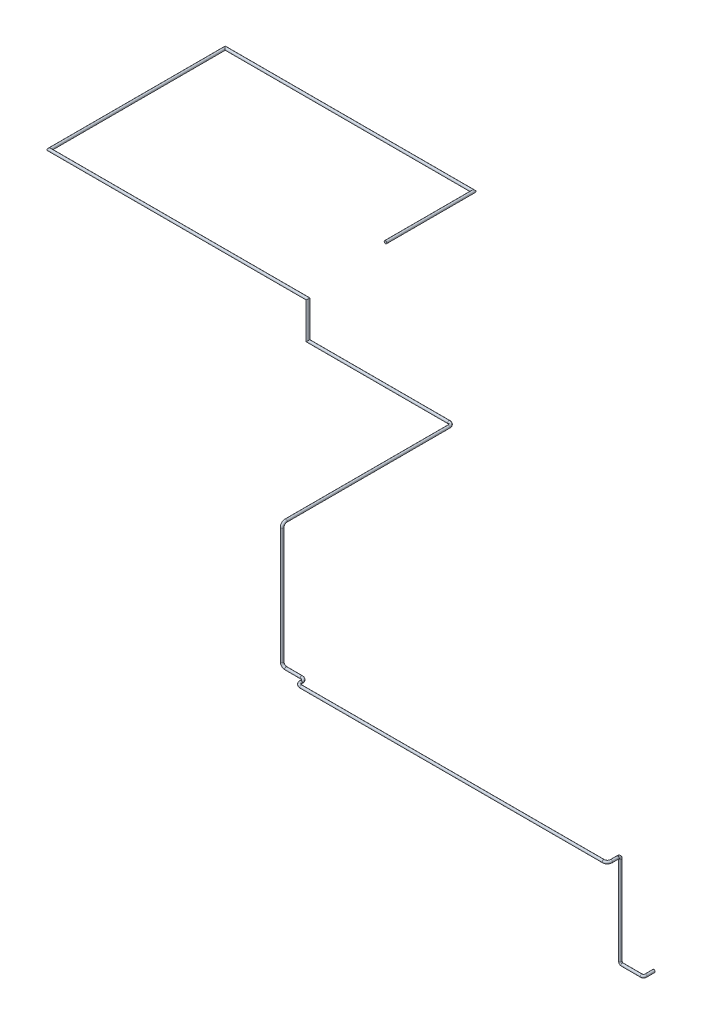
from build123d import *

# Parameters (mm, degrees)
CROQUIS1_R              = 25.4
SALIENTE_EXTRUIR1_DEPTH = 100
CROQUIS6_R              = 25.4
CROQUIS7_R              = 25


with BuildPart() as part:
    # Croquis1 → Saliente-Extruir1 (new body)
    with BuildSketch(Plane.XY):
        Circle(CROQUIS1_R)
    extrude(amount=SALIENTE_EXTRUIR1_DEPTH)

    # Barrer2: sweep along a curve in space
    with BuildLine() as barrer2_path:
        Line((0, 0, 100), (0, 0, 125))
        ThreePointArc((0, 0, 125), (-21.966991411, 0, 178.033008589), (-75, 0, 200))
        Line((-75, 0, 200), (-5925, 0, 200))
        ThreePointArc((-5925, 0, 200), (-5978.033008589, 0, 178.033008589), (-6000, 0, 125))
        Line((-6000, 0, 125), (-6000, 0, 115))
        ThreePointArc((-6000, 0, 115), (-6021.966991411, 0, 61.966991411), (-6075, 0, 40))
        Line((-6075, 0, 40), (-6375, 0, 40))
        ThreePointArc((-6375, 0, 40), (-6428.033008589, 21.966991411, 40), (-6450, 75, 40))
        Line((-6450, 75, 40), (-6450, 2325, 40))
        ThreePointArc((-6450, 2325, 40), (-6450, 2378.033008589, 18.033008589), (-6450, 2400, -35))
        Line((-6450, 2400, -35), (-6450, 2400, -3185))
        ThreePointArc((-6450, 2400, -3185), (-6471.966991411, 2400, -3238.033008589), (-6525, 2400, -3260))
        Line((-6525, 2400, -3260), (-9250, 2400, -3260))
        Line((-9250, 2400, -3260), (-9250, 3100, -3260))
        Line((-9250, 3100, -3260), (-14250, 3100, -3260))
        Line((-14250, 3100, -3260), (-14250, 3100, -6660))
        Line((-14250, 3100, -6660), (-9450, 3100, -6660))
        Line((-9450, 3100, -6660), (-9450, 3100, -4960))
    # Croquis6 → Barrer2 (sweep)
    with BuildSketch(Plane.XY.offset(100)):
        Circle(CROQUIS6_R)
    sweep(path=barrer2_path.line, transition=Transition.RIGHT)

    # Barrer3: sweep along a curve in space
    with BuildLine() as barrer3_path:
        Line((0, 0, 0), (0, 0, -10))
        ThreePointArc((0, 0, -10), (0, -11.715728753, -38.284271247), (0, -40, -50))
        Line((0, -40, -50), (0, -1760, -50))
        ThreePointArc((0, -1760, -50), (11.715728753, -1788.284271247, -50), (40, -1800, -50))
        Line((40, -1800, -50), (410, -1800, -50))
        ThreePointArc((410, -1800, -50), (438.284271247, -1800, -61.715728753), (450, -1800, -90))
        Line((450, -1800, -90), (450, -1800, -250))
    # Croquis7 → Barrer3 (sweep)
    with BuildSketch(Plane(origin=(0, 0, 0), x_dir=(-1, 0, 0), z_dir=(0, 0, -1))):
        Circle(CROQUIS7_R)
    sweep(path=barrer3_path.line)


solid = part.part
